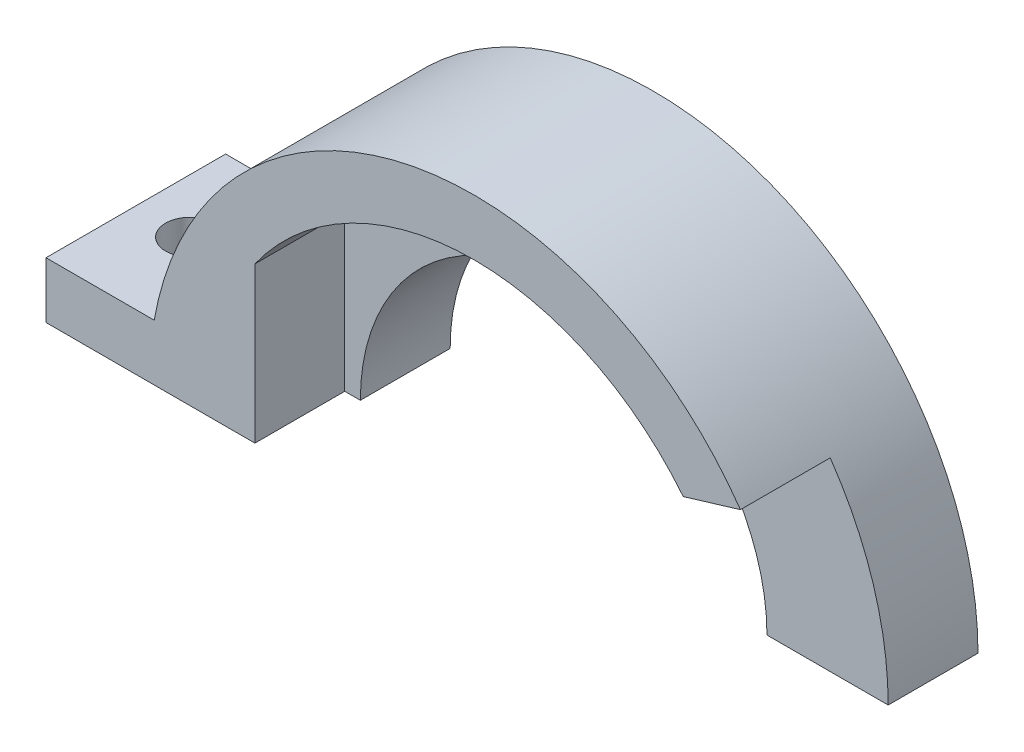
from build123d import *

# Parameters (mm, degrees)
BOSS_EXTRUDE1_DEPTH = 8
CUT_EXTRUDE2_DEPTH  = 8
BOSS_EXTRUDE2_START = 8
BOSS_EXTRUDE2_DEPTH = 8
BOSS_EXTRUDE3_DEPTH = 16
SKETCH8_R           = 2.165
CUT_EXTRUDE3_DEPTH  = 46.694096166


with BuildPart() as part:
    # Sketch1 → Boss-Extrude1 (new body)
    with BuildSketch(Plane.XY):
        with BuildLine():
            Line((-19.5, 13.830605225), (-19.5, 0))
            Line((-19.5, 0), (-28.9068116, 0))
            ThreePointArc((-28.9068116, 0), (0, 28.9068116), (28.9068116, 0))
            Line((28.9068116, 0), (23.9068116, 0))
            ThreePointArc((23.9068116, 0), (7.257851427, 22.778481809), (-19.5, 13.830605225))
        make_face()
    extrude(amount=BOSS_EXTRUDE1_DEPTH)

    # Sketch5 → Cut-Extrude2 (cut)
    with BuildSketch(Plane(origin=(0, 0, 0), x_dir=(-1, 0, 0), z_dir=(0, 0, -1))):
        Polygon((0, 0), (-18.650935532, 14.955876592), (-43.503762329, 22.442447281), (-58.13318285, -8.31229871), align=None)
    extrude(amount=-CUT_EXTRUDE2_DEPTH, mode=Mode.SUBTRACT)

    # Sketch6 → Boss-Extrude2 (add)
    with BuildSketch(Plane(origin=(0, 0, 0), x_dir=(-1, 0, 0), z_dir=(0, 0, -1)).offset(BOSS_EXTRUDE2_START)):
        with BuildLine():
            Line((-28.9068116, 0), (-18.11056, 0))
            ThreePointArc((-18.11056, 0), (0, 18.11056), (18.11056, 0))
            Line((18.11056, 0), (28.9068116, 0))
            ThreePointArc((28.9068116, 0), (0, 28.9068116), (-28.9068116, 0))
        make_face()
    extrude(amount=-BOSS_EXTRUDE2_DEPTH)

    # Sketch7 → Boss-Extrude3 (add, through all)
    with BuildSketch(Plane(origin=(0, 0, -8), x_dir=(-1, 0, 0), z_dir=(0, 0, -1))):
        with BuildLine():
            Line((28.9068116, 0), (38.11056, 0))
            Line((38.11056, 0), (38.11056, 5))
            Line((38.11056, 5), (28.471103893, 5))
            ThreePointArc((28.471103893, 5), (28.797678666, 2.509474109), (28.9068116, 0))
        make_face()
    extrude(amount=-BOSS_EXTRUDE3_DEPTH)

    # Sketch8 → Cut-Extrude3 (cut, through all)
    with BuildSketch(Plane(origin=(0, 5, 0), x_dir=(1, 0, 0), z_dir=(0, 1, 0))):
        with Locations(Location((-33.290831946, 0, 0), (0, 0, 270))):
            Circle(SKETCH8_R)
    extrude(amount=-CUT_EXTRUDE3_DEPTH, mode=Mode.SUBTRACT)


solid = part.part
